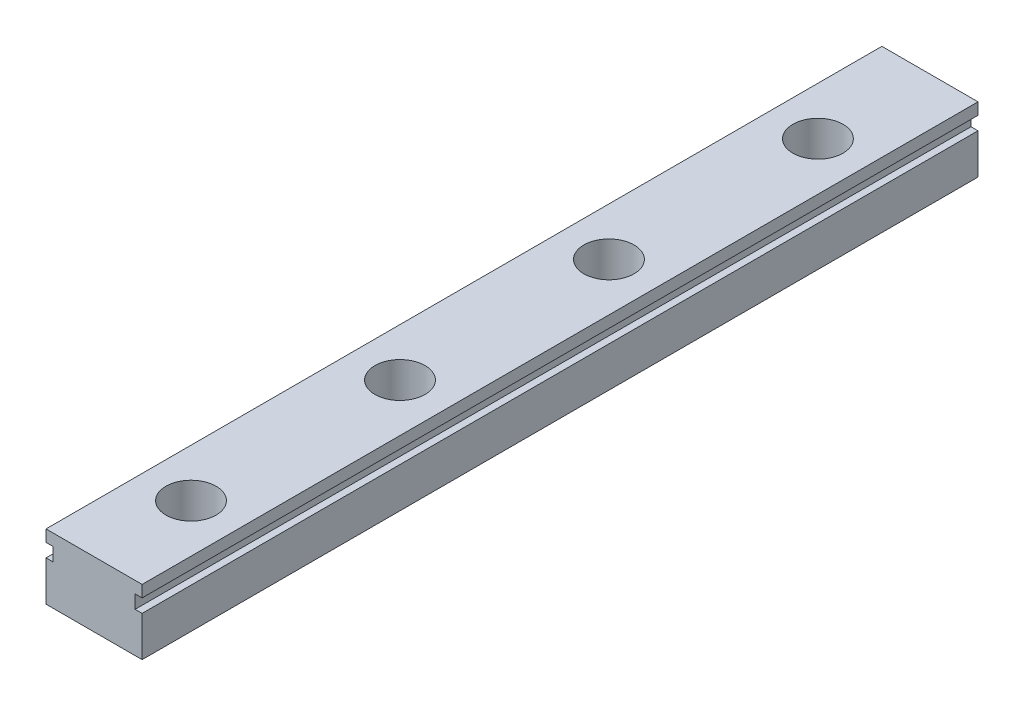
from build123d import *

# Parameters (mm, degrees)
SKETCH1_W           = 11.5
SKETCH1_H           = 7.8
BOSS_EXTRUDE1_DEPTH = 100
SKETCH2_W           = 0.835250229
SKETCH2_H           = 1.6
CUT_EXTRUDE1_DEPTH  = 101.241071922
SKETCH3_R           = 3
CUT_EXTRUDE2_DEPTH  = 4.7
SKETCH4_R           = 1.7
CUT_EXTRUDE3_DEPTH  = 101.27538332


with BuildPart() as part:
    # Sketch1 → Boss-Extrude1 (new body)
    with BuildSketch(Plane.XY):
        Rectangle(SKETCH1_W, SKETCH1_H)
    extrude(amount=BOSS_EXTRUDE1_DEPTH)

    # Sketch2 → Cut-Extrude1 (cut, through all)
    with BuildSketch(Plane.XY.offset(100)):
        with Locations((5.332374886, 1.7)):
            Rectangle(SKETCH2_W, SKETCH2_H)
        with Locations((-5.332374886, 1.7)):
            Rectangle(SKETCH2_W, SKETCH2_H)
    extrude(amount=-CUT_EXTRUDE1_DEPTH, mode=Mode.SUBTRACT)

    # Sketch3 → Cut-Extrude2 (cut)
    with BuildSketch(Plane(origin=(0, 3.9, 0), x_dir=(1, 0, 0), z_dir=(0, 1, 0))):
        with Locations(Location((0, -88.4, 0), (0, 0, 270))):
            Circle(SKETCH3_R)
        with Locations(Location((0, -63.4, 0), (0, 0, 270))):
            Circle(SKETCH3_R)
        with Locations(Location((0, -38.4, 0), (0, 0, 270))):
            Circle(SKETCH3_R)
        with Locations(Location((0, -13.4, 0), (0, 0, 270))):
            Circle(SKETCH3_R)
        with Locations((0, 11.6)):
            Circle(SKETCH3_R)
        with Locations((0, 36.6)):
            Circle(SKETCH3_R)
        with Locations((0, 61.6)):
            Circle(SKETCH3_R)
        with Locations((0, 86.6)):
            Circle(SKETCH3_R)
        with Locations((0, 111.6)):
            Circle(SKETCH3_R)
        with Locations((0, 136.6)):
            Circle(SKETCH3_R)
        with Locations((0, 161.6)):
            Circle(SKETCH3_R)
        with Locations((0, 186.6)):
            Circle(SKETCH3_R)
        with Locations((0, 211.6)):
            Circle(SKETCH3_R)
        with Locations((0, 236.6)):
            Circle(SKETCH3_R)
        with Locations((0, 261.6)):
            Circle(SKETCH3_R)
        with Locations((0, 286.6)):
            Circle(SKETCH3_R)
        with Locations((0, 311.6)):
            Circle(SKETCH3_R)
        with Locations((0, 336.6)):
            Circle(SKETCH3_R)
        with Locations((0, 361.6)):
            Circle(SKETCH3_R)
        with Locations((0, 386.6)):
            Circle(SKETCH3_R)
        with Locations((0, 411.6)):
            Circle(SKETCH3_R)
        with Locations((0, 436.6)):
            Circle(SKETCH3_R)
        with Locations((0, 461.6)):
            Circle(SKETCH3_R)
        with Locations((0, 486.6)):
            Circle(SKETCH3_R)
        with Locations((0, 511.6)):
            Circle(SKETCH3_R)
    extrude(amount=-CUT_EXTRUDE2_DEPTH, mode=Mode.SUBTRACT)

    # Sketch4 → Cut-Extrude3 (cut, through all)
    with BuildSketch(Plane(origin=(0, -0.8, 0), x_dir=(1, 0, 0), z_dir=(0, 1, 0))):
        with Locations(Location((0, -88.4, 0), (0, 0, 270))):
            Circle(SKETCH4_R)
        with Locations(Location((0, -63.4, 0), (0, 0, 270))):
            Circle(SKETCH4_R)
        with Locations(Location((0, -38.4, 0), (0, 0, 270))):
            Circle(SKETCH4_R)
        with Locations(Location((0, -13.4, 0), (0, 0, 270))):
            Circle(SKETCH4_R)
        with Locations((0, 11.6)):
            Circle(SKETCH4_R)
        with Locations((0, 36.6)):
            Circle(SKETCH4_R)
        with Locations((0, 61.6)):
            Circle(SKETCH4_R)
        with Locations((0, 86.6)):
            Circle(SKETCH4_R)
        with Locations((0, 111.6)):
            Circle(SKETCH4_R)
        with Locations((0, 136.6)):
            Circle(SKETCH4_R)
        with Locations((0, 161.6)):
            Circle(SKETCH4_R)
        with Locations((0, 186.6)):
            Circle(SKETCH4_R)
        with Locations((0, 211.6)):
            Circle(SKETCH4_R)
        with Locations((0, 236.6)):
            Circle(SKETCH4_R)
        with Locations((0, 261.6)):
            Circle(SKETCH4_R)
        with Locations((0, 286.6)):
            Circle(SKETCH4_R)
        with Locations((0, 311.6)):
            Circle(SKETCH4_R)
        with Locations((0, 336.6)):
            Circle(SKETCH4_R)
        with Locations((0, 361.6)):
            Circle(SKETCH4_R)
        with Locations((0, 386.6)):
            Circle(SKETCH4_R)
        with Locations((0, 411.6)):
            Circle(SKETCH4_R)
        with Locations((0, 436.6)):
            Circle(SKETCH4_R)
        with Locations((0, 461.6)):
            Circle(SKETCH4_R)
        with Locations((0, 486.6)):
            Circle(SKETCH4_R)
        with Locations((0, 511.6)):
            Circle(SKETCH4_R)
    extrude(amount=-CUT_EXTRUDE3_DEPTH, mode=Mode.SUBTRACT)


solid = part.part
